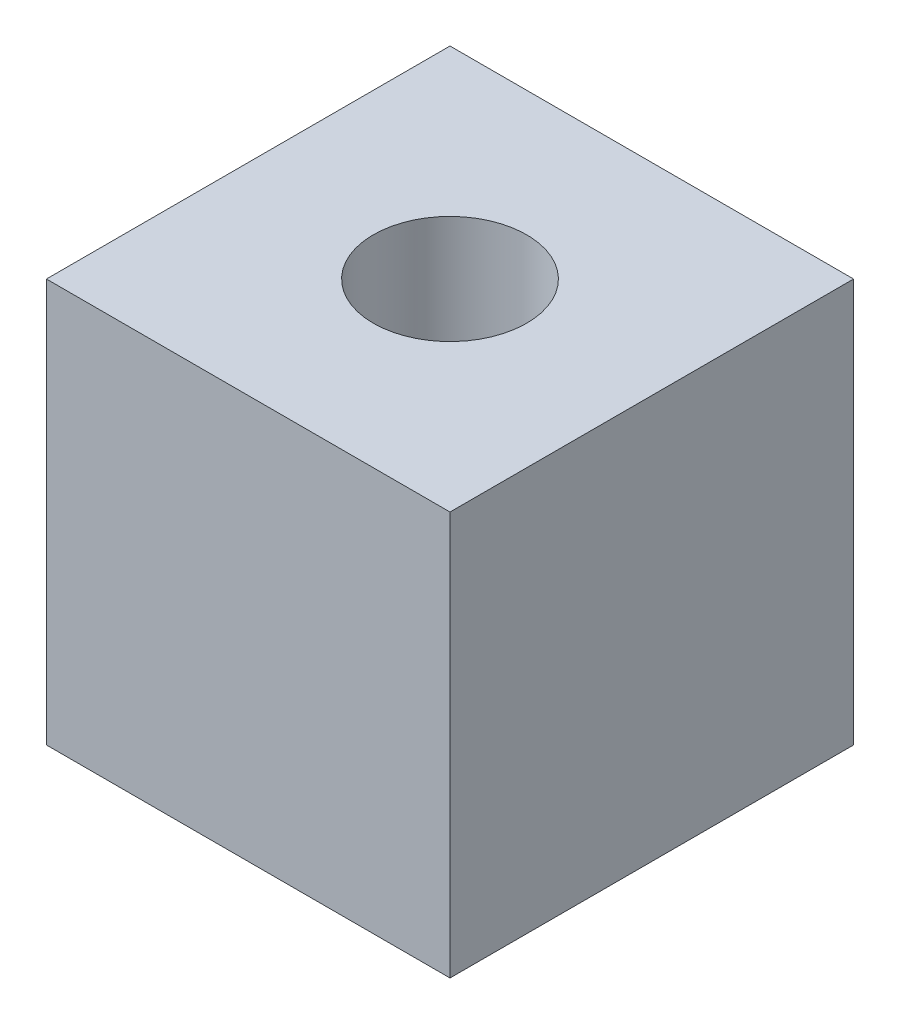
from build123d import *

# Parameters (mm, degrees)
SKETCH1_W           = 10
SKETCH1_H           = 10
BOSS_EXTRUDE1_DEPTH = 10
SKETCH2_R           = 1.9
CUT_EXTRUDE1_DEPTH  = 8.5


with BuildPart() as part:
    # Sketch1 → Boss-Extrude1 (new body)
    with BuildSketch(Plane(origin=(0, 0, 0), x_dir=(1, 0, 0), z_dir=(0, 1, 0))):
        with Locations((5, 5)):
            Rectangle(SKETCH1_W, SKETCH1_H)
    extrude(amount=BOSS_EXTRUDE1_DEPTH)

    # Sketch2 → Cut-Extrude1 (cut)
    with BuildSketch(Plane(origin=(0, 10, 0), x_dir=(1, 0, 0), z_dir=(0, 1, 0))):
        with Locations(Location((5, 5, 0), (0, 0, 270))):
            Circle(SKETCH2_R)
    extrude(amount=-CUT_EXTRUDE1_DEPTH, mode=Mode.SUBTRACT)


solid = part.part
